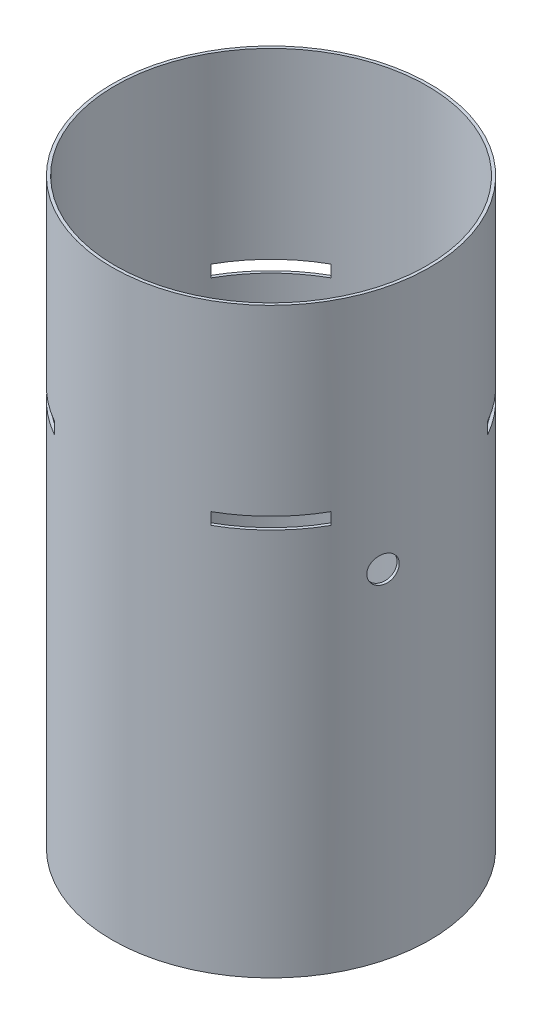
from build123d import *

# Parameters (mm, degrees)
SKETCH1_R           = 76.2
SKETCH1_R_2         = 74.7776
BOSS_EXTRUDE1_DEPTH = 139.7
SKETCH2_W           = 40.64
SKETCH2_H           = 5.715
CUT_EXTRUDE1_DEPTH  = 177.434038666
CIRPATTERN1_COUNT   = 4
SKETCH3_R           = 6.35
CUT_EXTRUDE2_DEPTH  = 6.35


with BuildPart() as part:
    # Sketch1 → Boss-Extrude1 (new, symmetric)
    with BuildSketch(Plane(origin=(0, 0, 0), x_dir=(1, 0, 0), z_dir=(0, 1, 0))):
        with Locations(Location((0, 0, 0), (0, 0, 270))):
            Circle(SKETCH1_R)
        with Locations(Location((0, 0, 0), (0, 0, 270))):
            Circle(SKETCH1_R_2, mode=Mode.SUBTRACT)
    extrude(amount=BOSS_EXTRUDE1_DEPTH, both=True)

    # Sketch2 → Cut-Extrude1 (cut, through all)
    with BuildSketch(Plane(origin=(0, 0, 0), x_dir=(-0.7071067811865477, 0, -0.7071067811865475), z_dir=(0.7071067811865475, 0, -0.7071067811865477))):
        with Locations((0, 49.2125)):
            Rectangle(SKETCH2_W, SKETCH2_H)
    cut_extrude1 = extrude(amount=-CUT_EXTRUDE1_DEPTH, mode=Mode.SUBTRACT)

    # CirPattern1: Cut-Extrude1 ×4 about axis
    cirpattern1_axis = Axis((0, 0, 0), (0, 1, 0))
    for i in range(1, CIRPATTERN1_COUNT):
        add(cut_extrude1.rotate(cirpattern1_axis, i * 360 / CIRPATTERN1_COUNT), mode=Mode.SUBTRACT)

    # Sketch3 → Cut-Extrude2 (cut)
    with BuildSketch(Plane(origin=(74.977480859, 38.1, 20.090155447), x_dir=(0, -1, 0), z_dir=(0.9659258262890681, 0, 0.25881904510252135))):
        with Locations(Location((15.24, 0, 0), (0, 0, 90))):
            Circle(SKETCH3_R)
    extrude(amount=-CUT_EXTRUDE2_DEPTH, mode=Mode.SUBTRACT)


solid = part.part
